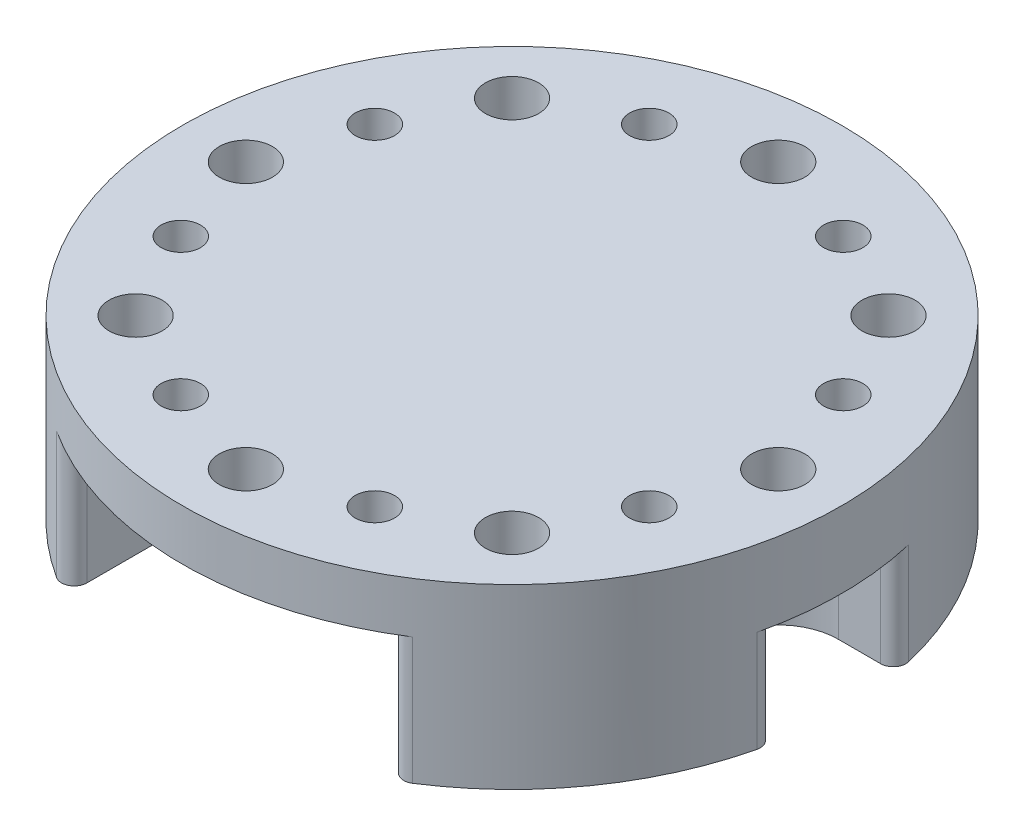
from build123d import *
from build123d.topology import SkipClean

# Parameters (mm, degrees)
SKETCH4_R           = 26
SKETCH4_R_2         = 2.1
SKETCH4_R_3         = 1.55
BOSS_EXTRUDE1_DEPTH = 4
SKETCH5_R           = 1.55
SKETCH5_R_2         = 2.1
BOSS_EXTRUDE2_DEPTH = 10
CUT_EXTRUDE1_START  = -8
CUT_EXTRUDE1_DEPTH  = 8
FILLET1_R           = 1


with BuildPart() as part:
    # Sketch4 → Boss-Extrude1 (new body)
    with BuildSketch(Plane(origin=(0, 0, 3), x_dir=(1, 0, 0), z_dir=(0, -1, 0))):
        with Locations(Location((0, -3, 0), (0, 0, 270))):
            Circle(SKETCH4_R)
        with Locations(Location((0, 18, 0), (0, 0, 270))):
            Circle(SKETCH4_R_2, mode=Mode.SUBTRACT)
        with Locations(Location((7.653668647, 15.47759065, 0), (0, 0, 270))):
            Circle(SKETCH4_R_3, mode=Mode.SUBTRACT)
        with Locations(Location((14.849242405, 11.849242405, 0), (0, 0, 270))):
            Circle(SKETCH4_R_2, mode=Mode.SUBTRACT)
        with Locations(Location((18.47759065, 4.653668647, 0), (0, 0, 270))):
            Circle(SKETCH4_R_3, mode=Mode.SUBTRACT)
        with Locations(Location((21, -3, 0), (0, 0, 270))):
            Circle(SKETCH4_R_2, mode=Mode.SUBTRACT)
        with Locations(Location((18.47759065, -10.653668647, 0), (0, 0, 270))):
            Circle(SKETCH4_R_3, mode=Mode.SUBTRACT)
        with Locations(Location((14.849242405, -17.849242405, 0), (0, 0, 270))):
            Circle(SKETCH4_R_2, mode=Mode.SUBTRACT)
        with Locations(Location((7.653668647, -21.47759065, 0), (0, 0, 270))):
            Circle(SKETCH4_R_3, mode=Mode.SUBTRACT)
        with Locations(Location((0, -24, 0), (0, 0, 270))):
            Circle(SKETCH4_R_2, mode=Mode.SUBTRACT)
        with Locations(Location((-7.653668647, -21.47759065, 0), (0, 0, 270))):
            Circle(SKETCH4_R_3, mode=Mode.SUBTRACT)
        with Locations(Location((-14.849242405, -17.849242405, 0), (0, 0, 270))):
            Circle(SKETCH4_R_2, mode=Mode.SUBTRACT)
        with Locations(Location((-18.47759065, -10.653668647, 0), (0, 0, 270))):
            Circle(SKETCH4_R_3, mode=Mode.SUBTRACT)
        with Locations(Location((-21, -3, 0), (0, 0, 270))):
            Circle(SKETCH4_R_2, mode=Mode.SUBTRACT)
        with Locations(Location((-18.47759065, 4.653668647, 0), (0, 0, 270))):
            Circle(SKETCH4_R_3, mode=Mode.SUBTRACT)
        with Locations(Location((-14.849242405, 11.849242405, 0), (0, 0, 270))):
            Circle(SKETCH4_R_2, mode=Mode.SUBTRACT)
        with Locations(Location((-7.653668647, 15.47759065, 0), (0, 0, 270))):
            Circle(SKETCH4_R_3, mode=Mode.SUBTRACT)
    extrude(amount=BOSS_EXTRUDE1_DEPTH)

    # Sketch5 → Boss-Extrude2 (add)
    # profile 1 of 2: a face of its own
    with SkipClean():  # the faces are left unmerged after this step: merging them gives an invalid solid
        with BuildSketch(Plane.XZ.offset(4)):
            with BuildLine():
                Line((-12.5, 22.79802623), (-12.5, -22.79802623))
                ThreePointArc((-12.5, -22.79802623), (-26, 0), (-12.5, 22.79802623))
            make_face()
            with Locations(Location((-18.47759065, 7.653668647, 0), (0, 0, 270))):
                Circle(SKETCH5_R, mode=Mode.SUBTRACT)
            with Locations(Location((-18.47759065, -7.653668647, 0), (0, 0, 270))):
                Circle(SKETCH5_R, mode=Mode.SUBTRACT)
            with Locations(Location((-14.849242405, -14.849242405, 0), (0, 0, 270))):
                Circle(SKETCH5_R_2, mode=Mode.SUBTRACT)
            with Locations(Location((-21, 0, 0), (0, 0, 270))):
                Circle(SKETCH5_R_2, mode=Mode.SUBTRACT)
            with Locations(Location((-14.849242405, 14.849242405, 0), (0, 0, 270))):
                Circle(SKETCH5_R_2, mode=Mode.SUBTRACT)
        # profile 2 of 2: a face of its own
        with BuildSketch(Plane.XZ.offset(4)):
            with BuildLine():
                Line((12.5, -22.79802623), (12.5, 22.79802623))
                ThreePointArc((12.5, 22.79802623), (26, 0), (12.5, -22.79802623))
            make_face()
            with Locations(Location((18.47759065, -7.653668647, 0), (0, 0, 270))):
                Circle(SKETCH5_R, mode=Mode.SUBTRACT)
            with Locations(Location((18.47759065, 7.653668647, 0), (0, 0, 270))):
                Circle(SKETCH5_R, mode=Mode.SUBTRACT)
            with Locations(Location((14.849242405, 14.849242405, 0), (0, 0, 270))):
                Circle(SKETCH5_R_2, mode=Mode.SUBTRACT)
            with Locations(Location((21, 0, 0), (0, 0, 270))):
                Circle(SKETCH5_R_2, mode=Mode.SUBTRACT)
            with Locations(Location((14.849242405, -14.849242405, 0), (0, 0, 270))):
                Circle(SKETCH5_R_2, mode=Mode.SUBTRACT)
        extrude(amount=BOSS_EXTRUDE2_DEPTH)

    # Sketch6 → Cut-Extrude1 (cut)
    with SkipClean():  # the faces are left unmerged after this step: merging them gives an invalid solid
        with BuildSketch(Plane.XZ.offset(14).offset(CUT_EXTRUDE1_START)):
            with BuildLine():
                Line((21, 4.75), (25.562423594, 4.75))
                ThreePointArc((25.562423594, 4.75), (26, 0), (25.562423594, -4.75))
                Line((25.562423594, -4.75), (21, -4.75))
                ThreePointArc((21, -4.75), (16.25, 0), (21, 4.75))
            make_face()
            with BuildLine():
                Line((-21, -4.75), (-25.562423594, -4.75))
                ThreePointArc((-25.562423594, -4.75), (-26, 0), (-25.562423594, 4.75))
                Line((-25.562423594, 4.75), (-21, 4.75))
                ThreePointArc((-21, 4.75), (-16.25, 0), (-21, -4.75))
            make_face()
        extrude(amount=CUT_EXTRUDE1_DEPTH, mode=Mode.SUBTRACT)

    # Fillet1
    fillet1_edges = [part.edges().sort_by_distance(p)[0] for p in [
        (-25.562423594, -10, -4.75),
        (-25.562423594, -10, 4.75),
        (25.562423594, -10, 4.75),
        (25.562423594, -10, -4.75),
        (-12.5, -9, 22.79802623),
        (-12.5, -9, -22.79802623),
        (12.5, -9, -22.79802623),
        (12.5, -9, 22.79802623),
    ]]
    fillet(fillet1_edges, radius=FILLET1_R)


solid = part.part
